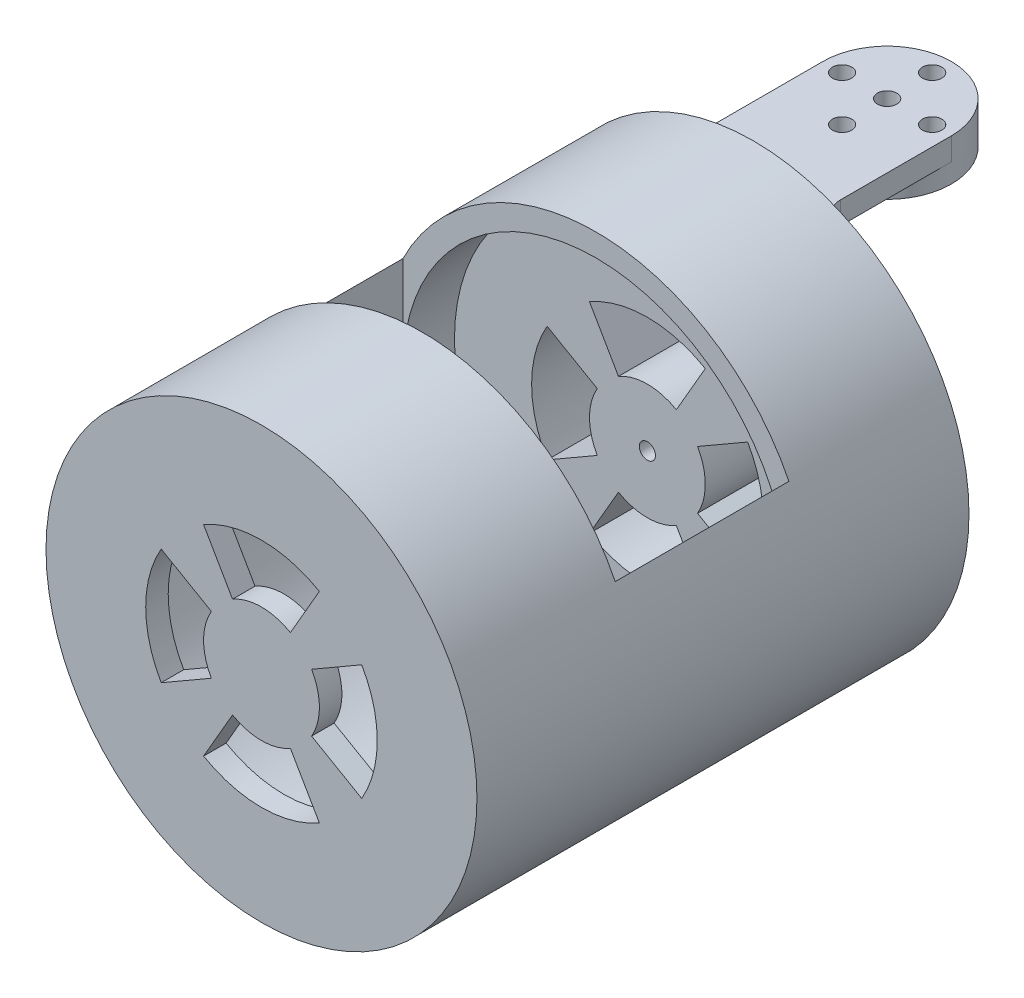
from build123d import *

# Parameters (mm, degrees)
SKETCH1_R           = 33.5
SKETCH1_R_2         = 30
BOSS_EXTRUDE1_DEPTH = 76.5
SKETCH3_R           = 33.5
BOSS_EXTRUDE2_DEPTH = 16.5
SKETCH4_W           = 20
SKETCH4_H           = 3.5
BOSS_EXTRUDE4_DEPTH = 30.867
SKETCH4_5_W         = 11
SKETCH4_5_H         = 3.5
BOSS_EXTRUDE5_DEPTH = 27
SKETCH4_7_R         = 1.25
CUT_EXTRUDE1_DEPTH  = 90.981942633
FILLET1_R           = 3.5
FILLET2_R           = 1.5
CUT_EXTRUDE4_DEPTH  = 103.136868955
BOSS_EXTRUDE7_START = 3
SKETCH6_10_R        = 10
BOSS_EXTRUDE7_DEPTH = 3
SKETCH12_R          = 5
SKETCH12_R_2        = 3
BOSS_EXTRUDE8_DEPTH = 1.5
SKETCH12_3_R        = 1.5
CUT_EXTRUDE7_DEPTH  = 101.439733174
CIRPATTERN1_COUNT   = 4
SKETCH12_4_R        = 1.5
CUT_EXTRUDE8_DEPTH  = 101.439733174
CUT_EXTRUDE9_DEPTH  = 90.981942633
CIRPATTERN2_COUNT   = 4
SKETCH13_W          = 60
SKETCH13_H          = 27
CUT_EXTRUDE11_DEPTH = 33.5
BOSS_EXTRUDE9_START = -3.5
SKETCH14_R          = 33.5
BOSS_EXTRUDE9_DEPTH = 3.5
CUT_EXTRUDE12_START = -4
CUT_EXTRUDE12_DEPTH = 4
CIRPATTERN3_COUNT   = 4
SKETCH16_R          = 2.7
CUT_EXTRUDE13_DEPTH = 10


with BuildPart() as part:
    # Sketch1 → Boss-Extrude1 (new body)
    with BuildSketch(Plane.XY):
        Circle(SKETCH1_R)
        Circle(SKETCH1_R_2, mode=Mode.SUBTRACT)
    extrude(amount=BOSS_EXTRUDE1_DEPTH)

    # Sketch3 → Boss-Extrude2 (add)
    with BuildSketch(Plane(origin=(0, 0, 0), x_dir=(-1, 0, 0), z_dir=(0, 0, -1))):
        Circle(SKETCH3_R)
    extrude(amount=-BOSS_EXTRUDE2_DEPTH)

    # Sketch4 → Boss-Extrude4 (add)
    with BuildSketch(Plane(origin=(0, 0, 0), x_dir=(-1, 0, 0), z_dir=(0, 0, -1))):
        with Locations((0, 27.05)):
            Rectangle(SKETCH4_W, SKETCH4_H)
    extrude(amount=BOSS_EXTRUDE4_DEPTH)

    # Sketch4<5> → Boss-Extrude5 (add)
    with BuildSketch(Plane(origin=(0, 0, 0), x_dir=(-1, 0, 0), z_dir=(0, 0, -1))):
        with Locations((0, -27.25)):
            Rectangle(SKETCH4_5_W, SKETCH4_5_H)
    extrude(amount=BOSS_EXTRUDE5_DEPTH)

    # Sketch4<7> → Cut-Extrude1 (cut, through all)
    with BuildSketch(Plane(origin=(0, 0, 0), x_dir=(-1, 0, 0), z_dir=(0, 0, -1))):
        Circle(SKETCH4_7_R)
    extrude(amount=-CUT_EXTRUDE1_DEPTH, mode=Mode.SUBTRACT)

    # Fillet1
    fillet1_edges = [part.edges().sort_by_distance(p)[0] for p in [
        (10, 27.05, 0),
        (-10, 27.05, 0),
    ]]
    fillet(fillet1_edges, radius=FILLET1_R)

    # Fillet2
    fillet2_edges = [part.edges().sort_by_distance(p)[0] for p in [
        (5.5, -27.25, 0),
        (-5.5, -27.25, 0),
    ]]
    fillet(fillet2_edges, radius=FILLET2_R)

    # Sketch6 → Cut-Extrude4 (cut, through all)
    with BuildSketch(Plane.XZ.offset(-25.3)):
        with BuildLine():
            Line((10, -30.867), (10, -20.77379065))
            ThreePointArc((10, -20.77379065), (0, -30.77379065), (-10, -20.77379065))
            Line((-10, -20.77379065), (-10, -30.867))
            Line((-10, -30.867), (10, -30.867))
        make_face()
    extrude(amount=-CUT_EXTRUDE4_DEPTH, mode=Mode.SUBTRACT)

    # Sketch6<10> → Boss-Extrude7 (add)
    with BuildSketch(Plane.XZ.offset(-25.3).offset(BOSS_EXTRUDE7_START)):
        with Locations((0, -20.77379065)):
            Circle(SKETCH6_10_R)
    extrude(amount=-BOSS_EXTRUDE7_DEPTH)

    # Sketch12 → Boss-Extrude8 (add)
    with BuildSketch(Plane.XZ.offset(-22.3)):
        with Locations((0, -20.77379065)):
            Circle(SKETCH12_R)
        with Locations((0, -20.77379065)):
            Circle(SKETCH12_R_2, mode=Mode.SUBTRACT)
    extrude(amount=BOSS_EXTRUDE8_DEPTH)

    # Sketch12<3> → Cut-Extrude7 (cut, through all)
    with BuildSketch(Plane.XZ.offset(-22.3)):
        with Locations((-7, -20.77379065)):
            Circle(SKETCH12_3_R)
    cut_extrude7 = extrude(amount=-CUT_EXTRUDE7_DEPTH, mode=Mode.SUBTRACT)

    # CirPattern1: Cut-Extrude7 ×4 about axis
    cirpattern1_axis = Axis((0, 20.8, -20.77379065), (0, -1, 0))
    for i in range(1, CIRPATTERN1_COUNT):
        add(cut_extrude7.rotate(cirpattern1_axis, i * 360 / CIRPATTERN1_COUNT), mode=Mode.SUBTRACT)

    # Sketch12<4> → Cut-Extrude8 (cut, through all)
    with BuildSketch(Plane.XZ.offset(-22.3)):
        with Locations((0, -20.77379065)):
            Circle(SKETCH12_4_R)
    extrude(amount=-CUT_EXTRUDE8_DEPTH, mode=Mode.SUBTRACT)

    # Sketch4<8> → Cut-Extrude9 (cut, through all)
    with BuildSketch(Plane(origin=(0, 0, 0), x_dir=(-1, 0, 0), z_dir=(0, 0, -1))):
        with BuildLine():
            Line((15.588457268, 9), (7.794228634, 4.5))
            ThreePointArc((7.794228634, 4.5), (9, 0), (7.794228634, -4.5))
            Line((7.794228634, -4.5), (15.588457268, -9))
            ThreePointArc((15.588457268, -9), (18, 0), (15.588457268, 9))
        make_face()
    cut_extrude9 = extrude(amount=-CUT_EXTRUDE9_DEPTH, mode=Mode.SUBTRACT)

    # CirPattern2: Cut-Extrude9 ×4 about axis
    cirpattern2_axis = Axis((0, 0, 0), (0, 0, -1))
    for i in range(1, CIRPATTERN2_COUNT):
        add(cut_extrude9.rotate(cirpattern2_axis, i * 360 / CIRPATTERN2_COUNT), mode=Mode.SUBTRACT)

    # Sketch13 → Cut-Extrude11 (cut)
    with BuildSketch(Plane(origin=(0, 33.5, 0), x_dir=(1, 0, 0), z_dir=(0, 1, 0))):
        with Locations((0, -38)):
            Rectangle(SKETCH13_W, SKETCH13_H)
    extrude(amount=-CUT_EXTRUDE11_DEPTH, mode=Mode.SUBTRACT)

    # Sketch14 → Boss-Extrude9 (add)
    with BuildSketch(Plane.XY.offset(76.5).offset(BOSS_EXTRUDE9_START)):
        Circle(SKETCH14_R)
    extrude(amount=BOSS_EXTRUDE9_DEPTH)

    # Sketch14<3> → Cut-Extrude12 (cut)
    with BuildSketch(Plane.XY.offset(76.5).offset(CUT_EXTRUDE12_START)):
        with BuildLine():
            Line((15.588457268, 9), (7.794228634, 4.5))
            ThreePointArc((7.794228634, 4.5), (9, 0), (7.794228634, -4.5))
            Line((7.794228634, -4.5), (15.588457268, -9))
            ThreePointArc((15.588457268, -9), (18, 0), (15.588457268, 9))
        make_face()
    cut_extrude12 = extrude(amount=CUT_EXTRUDE12_DEPTH, mode=Mode.SUBTRACT)

    # CirPattern3: Cut-Extrude12 ×4 about axis
    cirpattern3_axis = Axis((0, 0, 16.5), (0, 0, -1))
    for i in range(1, CIRPATTERN3_COUNT):
        add(cut_extrude12.rotate(cirpattern3_axis, i * 360 / CIRPATTERN3_COUNT), mode=Mode.SUBTRACT)

    # Sketch16 → Cut-Extrude13 (cut)
    with BuildSketch(Plane.XZ.offset(29)):
        with Locations((0, -20.77379065)):
            Circle(SKETCH16_R)
        with BuildLine():
            Line((5.5, -27), (5.5, -20.77379065))
            ThreePointArc((5.5, -20.77379065), (0, -26.27379065), (-5.5, -20.77379065))
            Line((-5.5, -20.77379065), (-5.5, -27))
            Line((-5.5, -27), (5.5, -27))
        make_face()
    extrude(amount=-CUT_EXTRUDE13_DEPTH, mode=Mode.SUBTRACT)


solid = part.part
